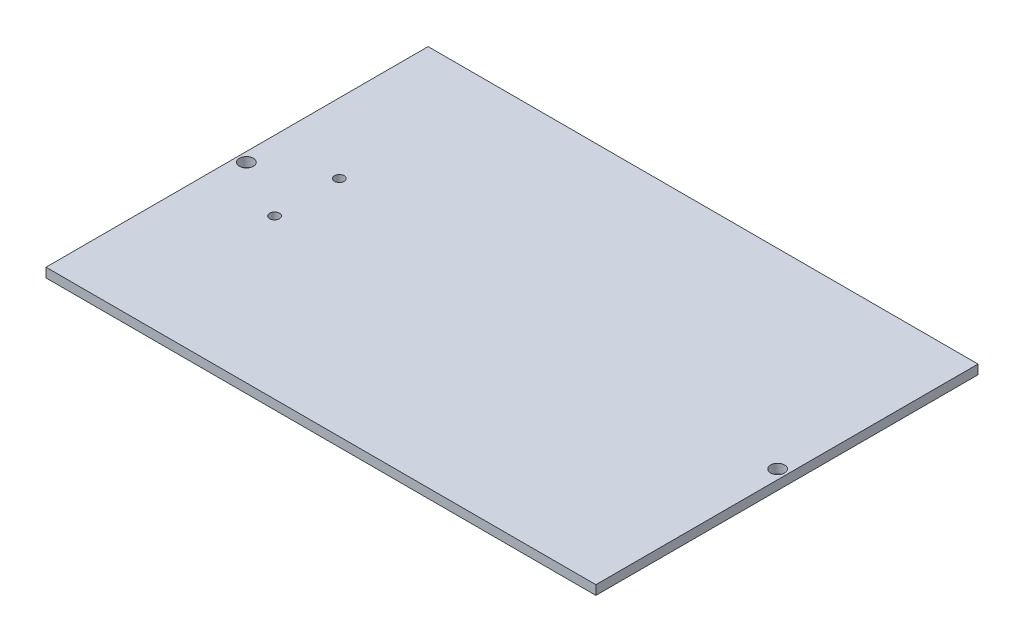
from build123d import *

# Parameters (mm, degrees)
SKETCH1_W           = 118
SKETCH1_H           = 82
BOSS_EXTRUDE1_DEPTH = 2
CUT_EXTRUDE1_DEPTH  = 2
SKETCH3_R           = 1.5
CUT_EXTRUDE2_DEPTH  = 10


with BuildPart() as part:
    # Sketch1 → Boss-Extrude1 (new body)
    with BuildSketch(Plane(origin=(0, 0, 0), x_dir=(1, 0, 0), z_dir=(0, 1, 0))):
        Rectangle(SKETCH1_W, SKETCH1_H)
    extrude(amount=BOSS_EXTRUDE1_DEPTH)

    # Sketch2 → Cut-Extrude1 (cut)
    with BuildSketch(Plane(origin=(0, 2, 0), x_dir=(1, 0, 0), z_dir=(0, 1, 0))):
        with BuildLine():
            ThreePointArc((-44, 8), (-45.05, 6.95), (-44, 5.9))
            Line((-44, 5.9), (-44, 8))
        make_face()
        with BuildLine():
            Line((-44, 8), (-44, 5.9))
            ThreePointArc((-44, 5.9), (-43.25753788, 6.20753788), (-42.95, 6.95))
            ThreePointArc((-42.95, 6.95), (-43.25753788, 7.69246212), (-44, 8))
        make_face()
        with BuildLine():
            ThreePointArc((-44, -5.9), (-45.05, -6.95), (-44, -8))
            Line((-44, -8), (-44, -5.9))
        make_face()
        with BuildLine():
            Line((-44, -5.9), (-44, -8))
            ThreePointArc((-44, -8), (-43.25753788, -7.69246212), (-42.95, -6.95))
            ThreePointArc((-42.95, -6.95), (-43.25753788, -6.20753788), (-44, -5.9))
        make_face()
    extrude(amount=-CUT_EXTRUDE1_DEPTH, mode=Mode.SUBTRACT)

    # Sketch3 → Cut-Extrude2 (cut)
    with BuildSketch(Plane(origin=(0, 2, 0), x_dir=(1, 0, 0), z_dir=(0, 1, 0))):
        with Locations(Location((-57, 0, 0), (0, 0, 270))):
            Circle(SKETCH3_R)
        with Locations(Location((57, 0, 0), (0, 0, 90))):
            Circle(SKETCH3_R)
    extrude(amount=-CUT_EXTRUDE2_DEPTH, mode=Mode.SUBTRACT)


solid = part.part
